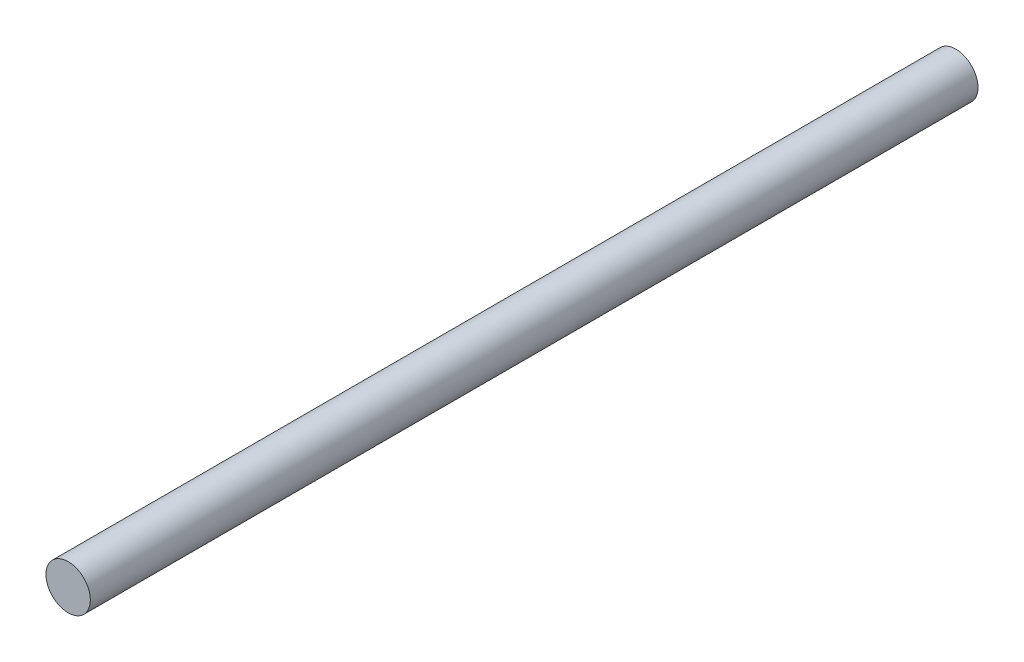
from build123d import *

# Parameters (mm, degrees)
SKETCH1_R           = 3.175
BOSS_EXTRUDE1_DEPTH = 127


with BuildPart() as part:
    # Sketch1 → Boss-Extrude1 (new body)
    with BuildSketch(Plane.XY):
        Circle(SKETCH1_R)
    extrude(amount=-BOSS_EXTRUDE1_DEPTH)


solid = part.part
